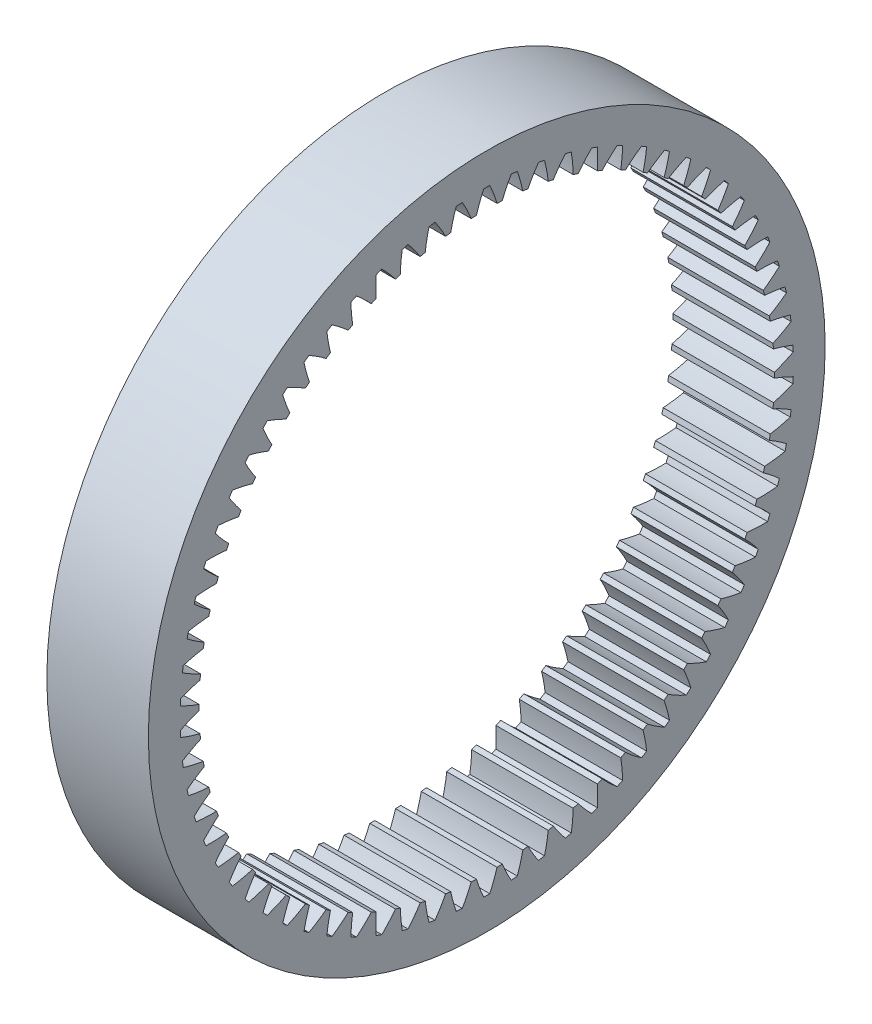
from build123d import *

# Parameters (mm, degrees)
BASPROSKE_W     = 12
BASPROSKE_H     = 6
TOOTHCUT_DEPTH  = 58.827329179
TEETHCUTS_COUNT = 70
TEETHCUTS_ANGLE = 354.857142857


with BuildPart() as part:
    # BasProSke → Base-Revolve (revolve)
    with BuildSketch(Plane(origin=(0, 0, 0), x_dir=(1, 0, 0), z_dir=(0, 1, 0)), mode=Mode.PRIVATE) as base_revolve_sk:
        with Locations((6, 37)):
            Rectangle(BASPROSKE_W, BASPROSKE_H)
    revolve(base_revolve_sk.sketch.rotate(Axis((-10, 0, 0), (1, 0, 0)), 180), axis=Axis((-10, 0, 0), (1, 0, 0)))

    # TooCutSke → ToothCut (cut, through all)
    with BuildSketch(Plane(origin=(0, 0, 0), x_dir=(0, 0, -1), z_dir=(1, 0, 0))):
        with BuildLine():
            ThreePointArc((1.226311931, 33.952460945), (0.832867774, 35.11607546), (0.358768615, 36.249224627))
            ThreePointArc((0.358768615, 36.249224627), (0, 36.251), (-0.358768615, 36.249224627))
            ThreePointArc((-0.358768615, 36.249224627), (-0.832867774, 35.11607546), (-1.226311931, 33.952460945))
            ThreePointArc((-1.226311931, 33.952460945), (0, 33.9746), (1.226311931, 33.952460945))
        make_face()
    toothcut = extrude(amount=TOOTHCUT_DEPTH, mode=Mode.SUBTRACT)

    # TeethCuts: ToothCut ×70 about axis
    teethcuts_axis = Axis((-10, 0, 0), (1, 0, 0))
    for i in range(1, TEETHCUTS_COUNT):
        add(toothcut.rotate(teethcuts_axis, i * TEETHCUTS_ANGLE / (TEETHCUTS_COUNT - 1)), mode=Mode.SUBTRACT)


solid = part.part
